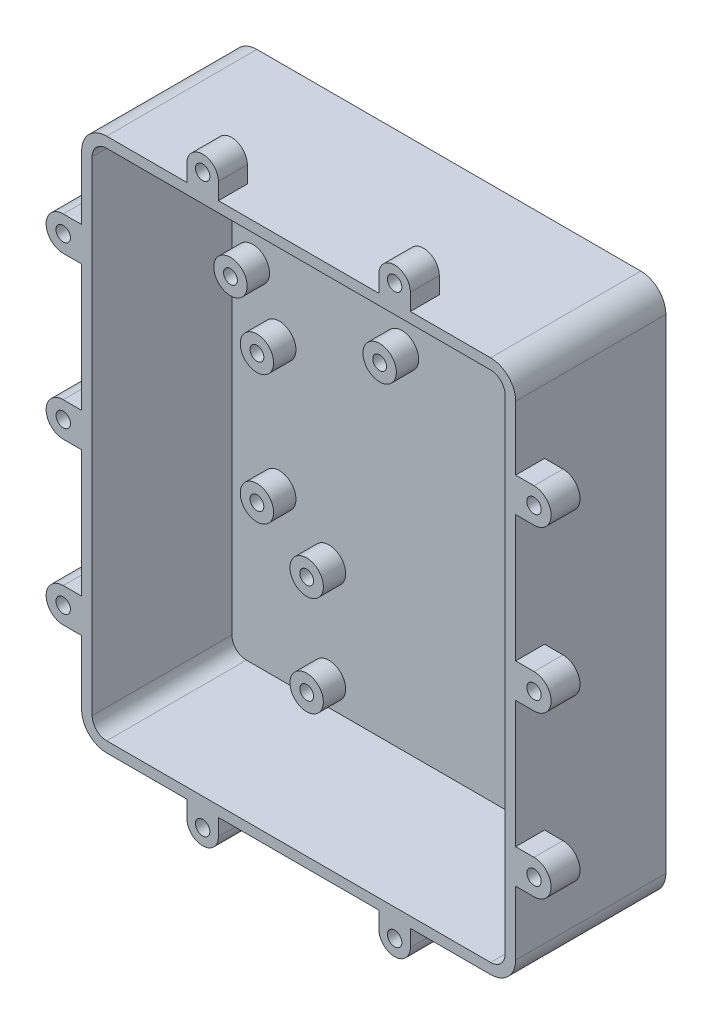
from build123d import *

# Parameters (mm, degrees)
SKETCH1_W               = 165.1
SKETCH1_H               = 203.2
BOSS_EXTRUDE1_DEPTH     = 57.15
FILLET1_R               = 9.525
SHELL1_T                = -4
SKETCH2_R               = 6.35
BOSS_EXTRUDE2_DEPTH     = 8.5
SKETCH3_R               = 2.625
CUT_EXTRUDE1_DEPTH      = 5
SKETCH2_3_R             = 6.35
BOSS_EXTRUDE6_DEPTH     = 8.5
SKETCH13_R              = 2.625
CUT_EXTRUDE5_DEPTH      = 7
BOSS_EXTRUDE3_DEPTH     = 11
CUT_EXTRUDE2_START      = -8
SKETCH4_6_R             = 2.75
CUT_EXTRUDE2_DEPTH      = 160.04398366
LPATTERN1_COUNT         = 2
LPATTERN1_PITCH         = 61.214
LPATTERN1_COUNT_DIR2    = 2
LPATTERN1_PITCH_DIR2    = 61.214
MIRROR1_COPY_1_DEPTH    = 11
MIRROR1_COPY_2_DEPTH    = 11
MIRROR1_COPY_3_DEPTH    = 11
MIRROR1_START           = -8
MIRROR1_COPY_4_SKETCH_R = 2.75
MIRROR1_COPY_4_DEPTH    = 160.04398366
MIRROR1_COPY_5_SKETCH_R = 2.75
MIRROR1_COPY_5_DEPTH    = 160.04398366
MIRROR1_COPY_6_SKETCH_R = 2.75
MIRROR1_COPY_6_DEPTH    = 160.04398366
MIRROR1_COPY_7_DEPTH    = 11
MIRROR1_COPY_8_SKETCH_R = 2.75
MIRROR1_COPY_8_DEPTH    = 160.04398366
BOSS_EXTRUDE5_DEPTH     = 11
SKETCH12_3_R            = 2.75
CUT_EXTRUDE3_DEPTH      = 8


with BuildPart() as part:
    # Sketch1 → Boss-Extrude1 (new body)
    with BuildSketch(Plane.XY):
        Rectangle(SKETCH1_W, SKETCH1_H)
    extrude(amount=BOSS_EXTRUDE1_DEPTH)

    # Fillet1
    fillet1_edges = [part.edges().sort_by_distance(p)[0] for p in [
        (82.55, 101.6, 28.575),
        (-82.55, 101.6, 28.575),
        (-82.55, -101.6, 28.575),
        (82.55, -101.6, 28.575),
    ]]
    fillet(fillet1_edges, radius=FILLET1_R)

    # Shell1
    shell1_openings = [part.faces().sort_by_distance(p)[0] for p in [
        (0, 0, 57.15),
    ]]
    offset(amount=SHELL1_T, openings=shell1_openings, kind=Kind.INTERSECTION)

    # Sketch2 → Boss-Extrude2 (add)
    with BuildSketch(Plane.XY.offset(4)):
        with Locations((-41.6, -88.279)):
            Circle(SKETCH2_R)
        with Locations((41.6, -88.279)):
            Circle(SKETCH2_R)
        with Locations((41.6, -50.279)):
            Circle(SKETCH2_R)
        with Locations((-41.6, -50.279)):
            Circle(SKETCH2_R)
    extrude(amount=BOSS_EXTRUDE2_DEPTH)

    # Sketch3 → Cut-Extrude1 (cut)
    with BuildSketch(Plane.XY.offset(12.5)):
        with Locations((-41.6, -88.279)):
            Circle(SKETCH3_R)
        with Locations((41.6, -88.279)):
            Circle(SKETCH3_R)
        with Locations((41.6, -50.279)):
            Circle(SKETCH3_R)
        with Locations((-41.6, -50.279)):
            Circle(SKETCH3_R)
    extrude(amount=-CUT_EXTRUDE1_DEPTH, mode=Mode.SUBTRACT)

    # Sketch2<3> → Boss-Extrude6 (add)
    with BuildSketch(Plane.XY.offset(4)):
        with Locations((-60.516, -35.221)):
            Circle(SKETCH2_3_R)
        with Locations((61.150666667, -35.221)):
            Circle(SKETCH2_3_R)
        with Locations((61.150666667, 14.011)):
            Circle(SKETCH2_3_R)
        with Locations((-60.516, 14.011)):
            Circle(SKETCH2_3_R)
        with Locations((-70.58, 34.245)):
            Circle(SKETCH2_3_R)
        with Locations((59.42, 34.245)):
            Circle(SKETCH2_3_R)
        with Locations((-70.58, 84.245)):
            Circle(SKETCH2_3_R)
        with Locations((59.42, 84.245)):
            Circle(SKETCH2_3_R)
        with Locations((-13.83, 34.245)):
            Circle(SKETCH2_3_R)
        with Locations((-13.83, 84.245)):
            Circle(SKETCH2_3_R)
    extrude(amount=BOSS_EXTRUDE6_DEPTH)

    # Sketch13 → Cut-Extrude5 (cut)
    with BuildSketch(Plane.XY.offset(12.5)):
        with Locations((-60.516, -35.221)):
            Circle(SKETCH13_R)
        with Locations((61.150666667, -35.221)):
            Circle(SKETCH13_R)
        with Locations((61.150666667, 14.011)):
            Circle(SKETCH13_R)
        with Locations((-60.516, 14.011)):
            Circle(SKETCH13_R)
        with Locations((-13.83, 34.245)):
            Circle(SKETCH13_R)
        with Locations((-70.58, 34.245)):
            Circle(SKETCH13_R)
        with Locations((59.42, 34.245)):
            Circle(SKETCH13_R)
        with Locations((59.42, 84.245)):
            Circle(SKETCH13_R)
        with Locations((-13.83, 84.245)):
            Circle(SKETCH13_R)
        with Locations((-70.58, 84.245)):
            Circle(SKETCH13_R)
    extrude(amount=-CUT_EXTRUDE5_DEPTH, mode=Mode.SUBTRACT)

    # Sketch4 → Boss-Extrude3 (add)
    with BuildSketch(Plane.XY.offset(57.15)):
        with BuildLine():
            Line((-82.55, -6.5), (-82.55, 6.5))
            Line((-82.55, 6.5), (-89.55, 6.5))
            ThreePointArc((-89.55, 6.5), (-96.05, 0), (-89.55, -6.5))
            Line((-89.55, -6.5), (-82.55, -6.5))
        make_face()
    boss_extrude3 = extrude(amount=-BOSS_EXTRUDE3_DEPTH)

    # Sketch4<6> → Cut-Extrude2 (cut)
    with BuildSketch(Plane.XY.offset(57.15).offset(CUT_EXTRUDE2_START)):
        with Locations((-89.55, 0)):
            Circle(SKETCH4_6_R)
    cut_extrude2 = extrude(amount=CUT_EXTRUDE2_DEPTH, mode=Mode.SUBTRACT)

    # LPattern1: Boss-Extrude3, Cut-Extrude2 2 × 2
    with Locations(*[Vector(0, 1, 0) * (i * LPATTERN1_PITCH) + Vector(0, -1, 0) * (j * LPATTERN1_PITCH_DIR2) for i in range(LPATTERN1_COUNT) for j in range(LPATTERN1_COUNT_DIR2) if (i, j) != (0, 0)]):
        add(boss_extrude3)
        add(cut_extrude2, mode=Mode.SUBTRACT)

    # Mirror1 copy 1 sketch → Mirror1 copy 1 (add)
    with BuildSketch(Plane(origin=(0, -61.214, 57.15), x_dir=(-1, 0, 0), z_dir=(0, 0, 1))):
        with BuildLine():
            Line((-82.55, 6.5), (-82.55, -6.5))
            Line((-82.55, -6.5), (-89.55, -6.5))
            ThreePointArc((-89.55, -6.5), (-96.05, 0), (-89.55, 6.5))
            Line((-89.55, 6.5), (-82.55, 6.5))
        make_face()
    extrude(amount=-MIRROR1_COPY_1_DEPTH)

    # Mirror1 copy 2 sketch → Mirror1 copy 2 (add)
    with BuildSketch(Plane(origin=(0, 61.214, 57.15), x_dir=(-1, 0, 0), z_dir=(0, 0, 1))):
        with BuildLine():
            Line((-82.55, 6.5), (-82.55, -6.5))
            Line((-82.55, -6.5), (-89.55, -6.5))
            ThreePointArc((-89.55, -6.5), (-96.05, 0), (-89.55, 6.5))
            Line((-89.55, 6.5), (-82.55, 6.5))
        make_face()
    extrude(amount=-MIRROR1_COPY_2_DEPTH)

    # Mirror1 copy 3 sketch → Mirror1 copy 3 (add)
    with BuildSketch(Plane(origin=(0, 0, 57.15), x_dir=(-1, 0, 0), z_dir=(0, 0, 1))):
        with BuildLine():
            Line((-82.55, 6.5), (-82.55, -6.5))
            Line((-82.55, -6.5), (-89.55, -6.5))
            ThreePointArc((-89.55, -6.5), (-96.05, 0), (-89.55, 6.5))
            Line((-89.55, 6.5), (-82.55, 6.5))
        make_face()
    extrude(amount=-MIRROR1_COPY_3_DEPTH)

    # Mirror1 copy 4 sketch → Mirror1 copy 4 (cut)
    with BuildSketch(Plane(origin=(0, -61.214, 57.15), x_dir=(-1, 0, 0), z_dir=(0, 0, 1)).offset(MIRROR1_START)):
        with Locations((-89.55, 0)):
            Circle(MIRROR1_COPY_4_SKETCH_R)
    extrude(amount=MIRROR1_COPY_4_DEPTH, mode=Mode.SUBTRACT)

    # Mirror1 copy 5 sketch → Mirror1 copy 5 (cut)
    with BuildSketch(Plane(origin=(0, 61.214, 57.15), x_dir=(-1, 0, 0), z_dir=(0, 0, 1)).offset(MIRROR1_START)):
        with Locations((-89.55, 0)):
            Circle(MIRROR1_COPY_5_SKETCH_R)
    extrude(amount=MIRROR1_COPY_5_DEPTH, mode=Mode.SUBTRACT)

    # Mirror1 copy 6 sketch → Mirror1 copy 6 (cut)
    with BuildSketch(Plane(origin=(0, 0, 57.15), x_dir=(-1, 0, 0), z_dir=(0, 0, 1)).offset(MIRROR1_START)):
        with Locations((-89.55, 0)):
            Circle(MIRROR1_COPY_6_SKETCH_R)
    extrude(amount=MIRROR1_COPY_6_DEPTH, mode=Mode.SUBTRACT)

    # Mirror1 copy 7 sketch → Mirror1 copy 7 (add)
    with BuildSketch(Plane(origin=(0, 0, 57.15), x_dir=(-1, 0, 0), z_dir=(0, 0, 1))):
        with BuildLine():
            Line((-82.55, 6.5), (-82.55, -6.5))
            Line((-82.55, -6.5), (-89.55, -6.5))
            ThreePointArc((-89.55, -6.5), (-96.05, 0), (-89.55, 6.5))
            Line((-89.55, 6.5), (-82.55, 6.5))
        make_face()
    extrude(amount=-MIRROR1_COPY_7_DEPTH)

    # Mirror1 copy 8 sketch → Mirror1 copy 8 (cut)
    with BuildSketch(Plane(origin=(0, 0, 57.15), x_dir=(-1, 0, 0), z_dir=(0, 0, 1)).offset(MIRROR1_START)):
        with Locations((-89.55, 0)):
            Circle(MIRROR1_COPY_8_SKETCH_R)
    extrude(amount=MIRROR1_COPY_8_DEPTH, mode=Mode.SUBTRACT)

    # Sketch12 → Boss-Extrude5 (add)
    with BuildSketch(Plane.XY.offset(57.15)):
        with BuildLine():
            Line((42.5125, -101.6), (30.5125, -101.6))
            Line((30.5125, -101.6), (30.5125, -107.95))
            ThreePointArc((30.5125, -107.95), (36.5125, -113.95), (42.5125, -107.95))
            Line((42.5125, -107.95), (42.5125, -101.6))
        make_face()
        with BuildLine():
            Line((-42.5125, -101.6), (-42.5125, -107.95))
            ThreePointArc((-42.5125, -107.95), (-36.5125, -113.95), (-30.5125, -107.95))
            Line((-30.5125, -107.95), (-30.5125, -101.6))
            Line((-30.5125, -101.6), (-42.5125, -101.6))
        make_face()
    boss_extrude5 = extrude(amount=-BOSS_EXTRUDE5_DEPTH)

    # Sketch12<3> → Cut-Extrude3 (cut)
    with BuildSketch(Plane.XY.offset(57.15)):
        with Locations((-36.5125, -107.95)):
            Circle(SKETCH12_3_R)
        with Locations((36.5125, -107.95)):
            Circle(SKETCH12_3_R)
    cut_extrude3 = extrude(amount=-CUT_EXTRUDE3_DEPTH, mode=Mode.SUBTRACT)

    # Mirror2: Boss-Extrude5, Cut-Extrude3 across plane
    add(boss_extrude5.mirror(Plane.ZX))
    add(cut_extrude3.mirror(Plane.ZX), mode=Mode.SUBTRACT)


solid = part.part
